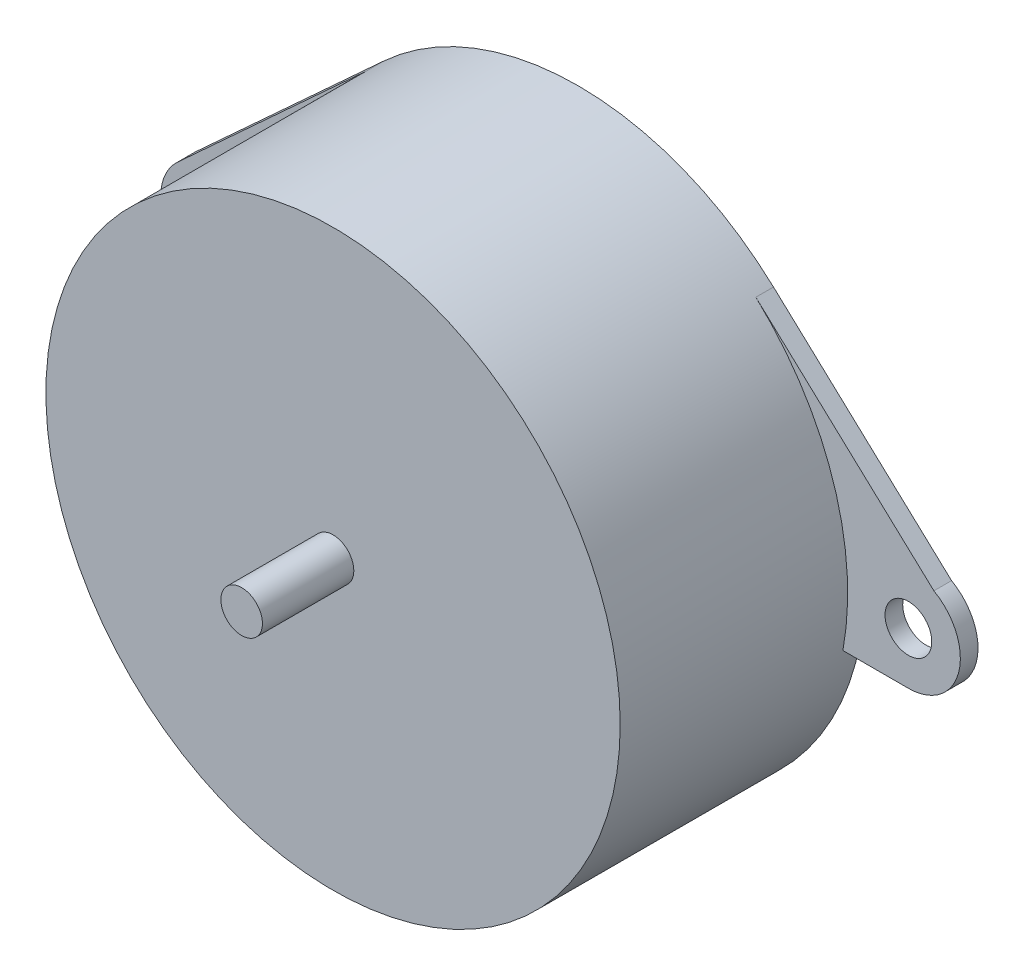
from build123d import *
from build123d.topology import SkipClean

# Parameters (mm, degrees)
CROQUIS1_R                   = 27.65
SALIENTE_EXTRUIR1_DEPTH      = 21.9
SALIENTE_EXTRUIR2_DEPTH      = 8.8
SALIENTE_EXTRUIR2_DEPTH_BACK = 34
CROQUIS2_R                   = 2
SALIENTE_EXTRUIR3_START      = 1.7
CROQUIS3_R                   = 2.25
CROQUIS3_R_2                 = 2
SALIENTE_EXTRUIR3_DEPTH      = 1.7
CROQUIS4_R                   = 5.55
SALIENTE_EXTRUIR4_DEPTH      = 2


with BuildPart() as part:
    # Croquis1 → Saliente-Extruir1 (new body)
    with BuildSketch(Plane.XY):
        Circle(CROQUIS1_R)
    extrude(amount=SALIENTE_EXTRUIR1_DEPTH)

    # Croquis2 → Saliente-Extruir2 (add, two sides: drawn at the far end of the back side and taken through both)
    with BuildSketch(Plane.XY.offset(21.9).offset(-SALIENTE_EXTRUIR2_DEPTH_BACK)):
        Circle(CROQUIS2_R)
    extrude(amount=SALIENTE_EXTRUIR2_DEPTH + SALIENTE_EXTRUIR2_DEPTH_BACK)

    # Croquis3 → Saliente-Extruir3 (add)
    with SkipClean():  # the faces are left unmerged after this step: merging them gives an invalid solid
        with BuildSketch(Plane(origin=(0, 0, 0), x_dir=(-1, 0, 0), z_dir=(0, 0, -1)).offset(SALIENTE_EXTRUIR3_START)):
            with BuildLine():
                Line((27.194162977, -5), (33.5, -5))
                ThreePointArc((33.5, -5), (38.159388464, -1.813863043), (36.880597015, 3.683960345))
                Line((36.880597015, 3.683960345), (18.694701493, 20.372300707))
                ThreePointArc((18.694701493, 20.372300707), (-0.0770274, 27.649892708), (-18.80791724, 20.267825466))
                Line((-18.80791724, 20.267825466), (-35.955174002, 4.355699785))
                ThreePointArc((-35.955174002, 4.355699785), (-38.336243321, -1.269153473), (-33.5, -5))
                Line((-33.5, -5), (-27.194162977, -5))
                ThreePointArc((-27.194162977, -5), (0, -27.65), (27.194162977, -5))
            make_face()
            with Locations((33.5, 0)):
                Circle(CROQUIS3_R, mode=Mode.SUBTRACT)
            with Locations(Location((0, 0, 0), (0, 0, 180))):
                Circle(CROQUIS3_R_2, mode=Mode.SUBTRACT)
            with Locations((-33.5, 0)):
                Circle(CROQUIS3_R, mode=Mode.SUBTRACT)
        extrude(amount=-SALIENTE_EXTRUIR3_DEPTH)

    # Croquis4 → Saliente-Extruir4 (add)
    with SkipClean():  # the faces are left unmerged after this step: merging them gives an invalid solid
        with BuildSketch(Plane(origin=(0, 0, -1.7), x_dir=(-1, 0, 0), z_dir=(0, 0, -1))):
            Circle(CROQUIS4_R)
        extrude(amount=SALIENTE_EXTRUIR4_DEPTH)


solid = part.part
